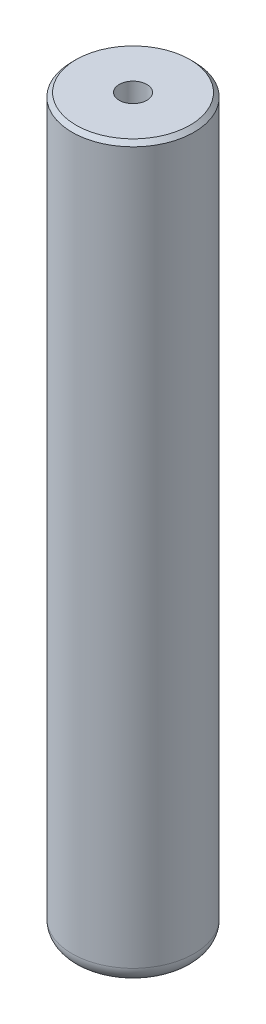
from build123d import *

# Parameters (mm, degrees)
SKETCH1_R                  = 15
BOSS_EXTRUDE1_DEPTH        = 180
FILLET1_R                  = 4
CHAMFER1_SIZE              = 1
M8X1_25_TAPPED_HOLE1_D     = 6.8
M8X1_25_TAPPED_HOLE1_DEPTH = 19.75
M8X1_25_TAPPED_HOLE1_TIP   = 2.042926105


with BuildPart() as part:
    # Sketch1 → Boss-Extrude1 (new body)
    with BuildSketch(Plane(origin=(0, 0, 0), x_dir=(1, 0, 0), z_dir=(0, 1, 0))):
        with Locations(Location((0, 0, 0), (0, 0, 90))):
            Circle(SKETCH1_R)
    extrude(amount=BOSS_EXTRUDE1_DEPTH)

    # Fillet1
    fillet1_edges = [part.edges().sort_by_distance(p)[0] for p in [
        (0, 0, 15),
    ]]
    fillet(fillet1_edges, radius=FILLET1_R)

    # Chamfer1
    chamfer1_edges = [part.edges().sort_by_distance(p)[0] for p in [
        (0, 180, 15),
    ]]
    chamfer(chamfer1_edges, length=CHAMFER1_SIZE)

    # M8x1.25 Tapped Hole1
    with Locations(Plane(origin=(0, 180, 0), x_dir=(1, 0, 0), z_dir=(0, 1, 0))):
        with Locations((0, 0)):
            Hole(M8X1_25_TAPPED_HOLE1_D / 2, depth=M8X1_25_TAPPED_HOLE1_DEPTH)
            with Locations((0, 0, -(M8X1_25_TAPPED_HOLE1_DEPTH + M8X1_25_TAPPED_HOLE1_TIP / 2))):  # 118° drill point
                Cone(0, M8X1_25_TAPPED_HOLE1_D / 2, M8X1_25_TAPPED_HOLE1_TIP, mode=Mode.SUBTRACT)


solid = part.part
